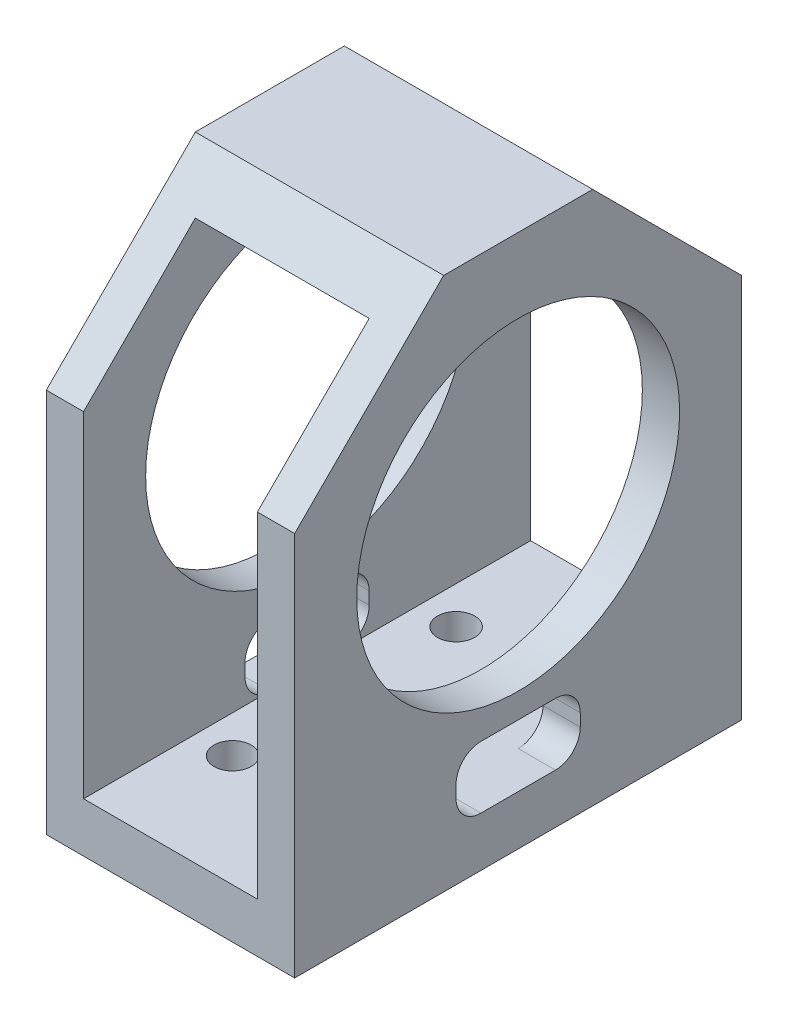
from build123d import *

# Parameters (mm, degrees)
SKETCH_1_W          = 20
SKETCH_1_H          = 36
EXTRUDE_1_DEPTH     = 4
SKETCH_2_W          = 3
SKETCH_2_H          = 36
EXTRUDE_2_DEPTH     = 36
SKETCH_3_W          = 20
SKETCH_3_H          = 36
EXTRUDE_3_DEPTH     = 3
SKETCH_4_R          = 13
CUT_EXTRUDE_1_DEPTH = 51.724747412
CUT_EXTRUDE_2_DEPTH = 51.724747412
SKETCH_6_R          = 1.5
CUT_EXTRUDE_3_DEPTH = 4
SKETCH_7_W          = 10
SKETCH_7_H          = 5
CUT_EXTRUDE_4_DEPTH = 51.724747412
FILLET_1_R          = 2


with BuildPart() as part:
    # 草图1 → 凸台-拉伸1 (new body)
    with BuildSketch(Plane(origin=(0, 0, 0), x_dir=(1, 0, 0), z_dir=(0, 1, 0))):
        Rectangle(SKETCH_1_W, SKETCH_1_H)
    extrude(amount=EXTRUDE_1_DEPTH)

    # 草图2 → 凸台-拉伸2 (add)
    with BuildSketch(Plane(origin=(0, 4, 0), x_dir=(1, 0, 0), z_dir=(0, 1, 0))):
        with Locations((-8.5, 0)):
            Rectangle(SKETCH_2_W, SKETCH_2_H)
        with Locations((8.5, 0)):
            Rectangle(SKETCH_2_W, SKETCH_2_H)
    extrude(amount=EXTRUDE_2_DEPTH)

    # 草图3 → 凸台-拉伸3 (add)
    with BuildSketch(Plane(origin=(0, 40, 0), x_dir=(1, 0, 0), z_dir=(0, 1, 0))):
        Rectangle(SKETCH_3_W, SKETCH_3_H)
    extrude(amount=EXTRUDE_3_DEPTH)

    # 草图4 → 切除-拉伸1 (cut, through all)
    with BuildSketch(Plane(origin=(10, 0, 0), x_dir=(0, 0, -1), z_dir=(1, 0, 0))):
        with Locations((0, 24)):
            Circle(SKETCH_4_R)
    extrude(amount=-CUT_EXTRUDE_1_DEPTH, mode=Mode.SUBTRACT)

    # 草图5 → 切除-拉伸2 (cut, through all)
    with BuildSketch(Plane(origin=(10, 0, 0), x_dir=(0, 0, -1), z_dir=(1, 0, 0))):
        Polygon((-6, 43), (-18, 31), (-18, 43), align=None)
        Polygon((18, 31), (18, 43), (6, 43), align=None)
    extrude(amount=-CUT_EXTRUDE_2_DEPTH, mode=Mode.SUBTRACT)

    # 草图6 → 切除-拉伸3 (cut)
    with BuildSketch(Plane(origin=(0, 4, 0), x_dir=(1, 0, 0), z_dir=(0, 1, 0))):
        with Locations(Location((4, 9, 0), (0, 0, 270))):
            Circle(SKETCH_6_R)
        with Locations(Location((-4, 9, 0), (0, 0, 90))):
            Circle(SKETCH_6_R)
        with Locations(Location((4, -9, 0), (0, 0, 90))):
            Circle(SKETCH_6_R)
        with Locations(Location((-4, -9, 0), (0, 0, 270))):
            Circle(SKETCH_6_R)
    extrude(amount=-CUT_EXTRUDE_3_DEPTH, mode=Mode.SUBTRACT)

    # 草图7 → 切除-拉伸4 (cut, through all)
    with BuildSketch(Plane(origin=(10, 0, 0), x_dir=(0, 0, -1), z_dir=(1, 0, 0))):
        with Locations((0, 6.5)):
            Rectangle(SKETCH_7_W, SKETCH_7_H)
    extrude(amount=-CUT_EXTRUDE_4_DEPTH, mode=Mode.SUBTRACT)

    # 圆角1
    fillet_1_edges = [part.edges().sort_by_distance(p)[0] for p in [
        (-8.5, 4, 5),
        (8.5, 4, 5),
        (-8.5, 9, 5),
        (8.5, 9, 5),
        (-8.5, 9, -5),
        (8.5, 9, -5),
        (-8.5, 4, -5),
        (8.5, 4, -5),
    ]]
    fillet(fillet_1_edges, radius=FILLET_1_R)


solid = part.part
